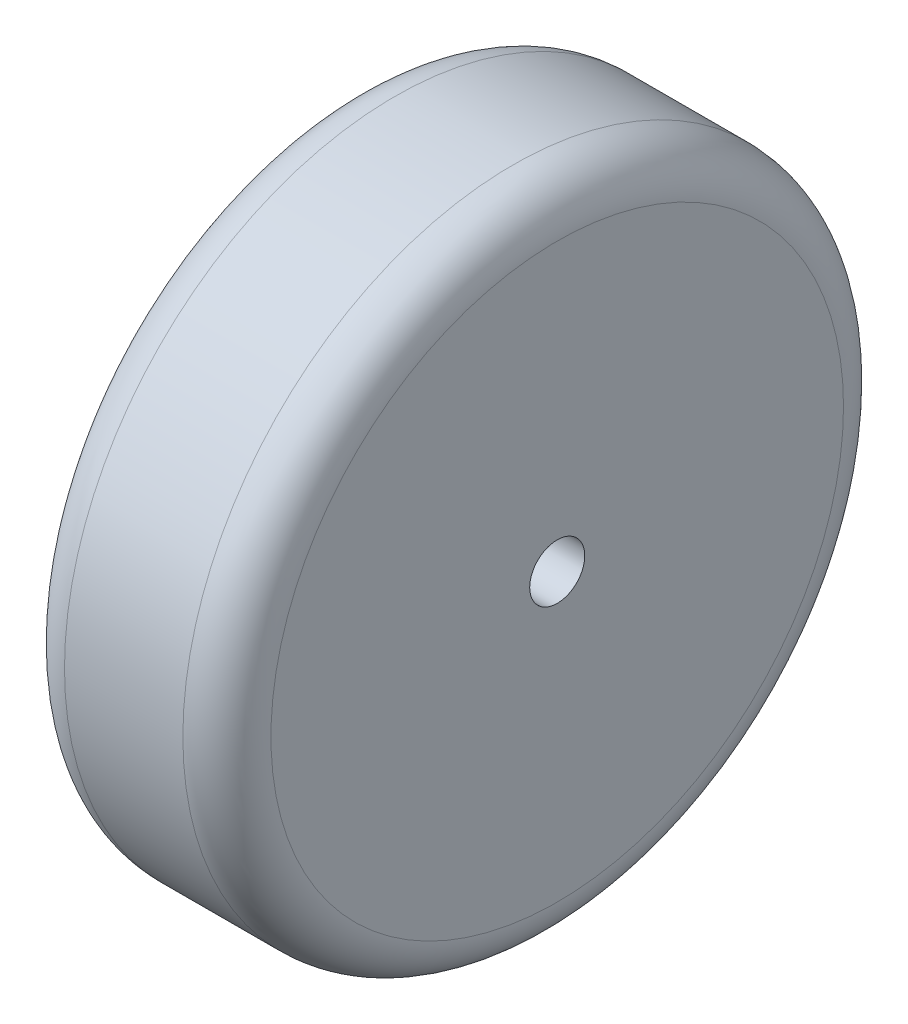
from build123d import *

# Parameters (mm, degrees)
SKETCH1_W = 23.8125
SKETCH1_H = 34.925
FILLET1_R = 5.08


with BuildPart() as part:
    # Sketch1 → Revolve1 (revolve)
    with BuildSketch(Plane(origin=(0, 0, 0), x_dir=(1, 0, 0), z_dir=(0, 1, 0))):
        with Locations((0, -20.6375)):
            Rectangle(SKETCH1_W, SKETCH1_H)
    revolve(axis=Axis((-11.90625, 0, 0), (1, 0, 0)))

    # Fillet1
    fillet1_edges = [part.edges().sort_by_distance(p)[0] for p in [
        (-11.90625, 0, -38.1),
        (11.90625, 0, -38.1),
    ]]
    fillet(fillet1_edges, radius=FILLET1_R)


solid = part.part
